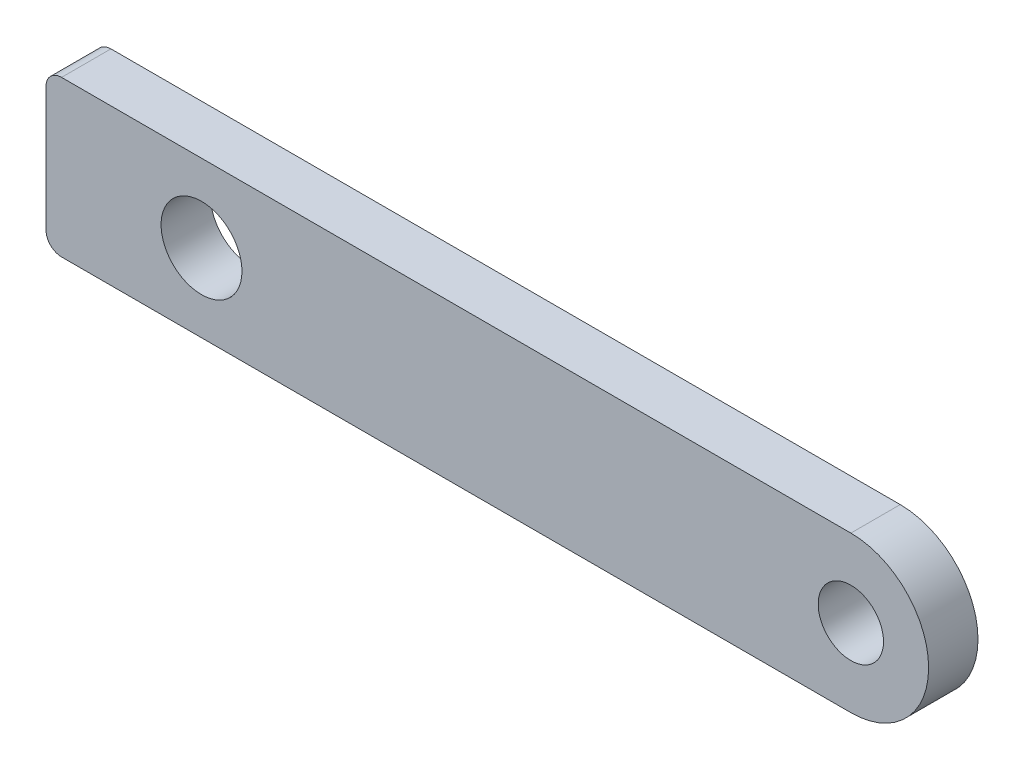
from build123d import *

# Parameters (mm, degrees)
BOSS_EXTRUDE1_DEPTH        = 3.175
F_4_2_4_2_DIAMETER_HOLE1_D = 4.2
F_5_2_5_2_DIAMETER_HOLE1_D = 5.2


with BuildPart() as part:
    # Sketch1 → Boss-Extrude1 (new body)
    with BuildSketch(Plane.XY.offset(3.175)):
        with BuildLine():
            Line((0, 9), (0, 1))
            ThreePointArc((0, 1), (0.292893219, 0.292893219), (1, 0))
            Line((1, 0), (51.75, 0))
            ThreePointArc((51.75, 0), (56.75, 5), (51.75, 10))
            Line((51.75, 10), (1, 10))
            ThreePointArc((1, 10), (0.292893219, 9.707106781), (0, 9))
        make_face()
    extrude(amount=-BOSS_EXTRUDE1_DEPTH)

    # Ø4.2 (4.2) Diameter Hole1 (through all)
    with Locations(Plane.XY.offset(3.175)):
        with Locations((51.75, 5)):
            Hole(F_4_2_4_2_DIAMETER_HOLE1_D / 2)

    # Ø5.2 (5.2) Diameter Hole1 (through all)
    with Locations(Plane.XY.offset(3.175)):
        with Locations((10, 5)):
            Hole(F_5_2_5_2_DIAMETER_HOLE1_D / 2)


solid = part.part
